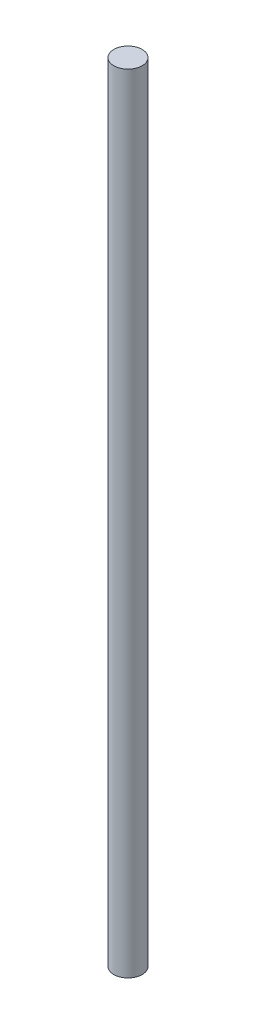
from build123d import *

# Parameters (mm, degrees)
SKETCH2_R           = 2.25
BOSS_EXTRUDE1_DEPTH = 62.5


with BuildPart() as part:
    # Sketch2 → Boss-Extrude1 (new, symmetric)
    with BuildSketch(Plane(origin=(0, 0, 0), x_dir=(1, 0, 0), z_dir=(0, 1, 0))):
        with Locations(Location((0, 0, 0), (0, 0, 270))):
            Circle(SKETCH2_R)
    extrude(amount=BOSS_EXTRUDE1_DEPTH, both=True)


solid = part.part
